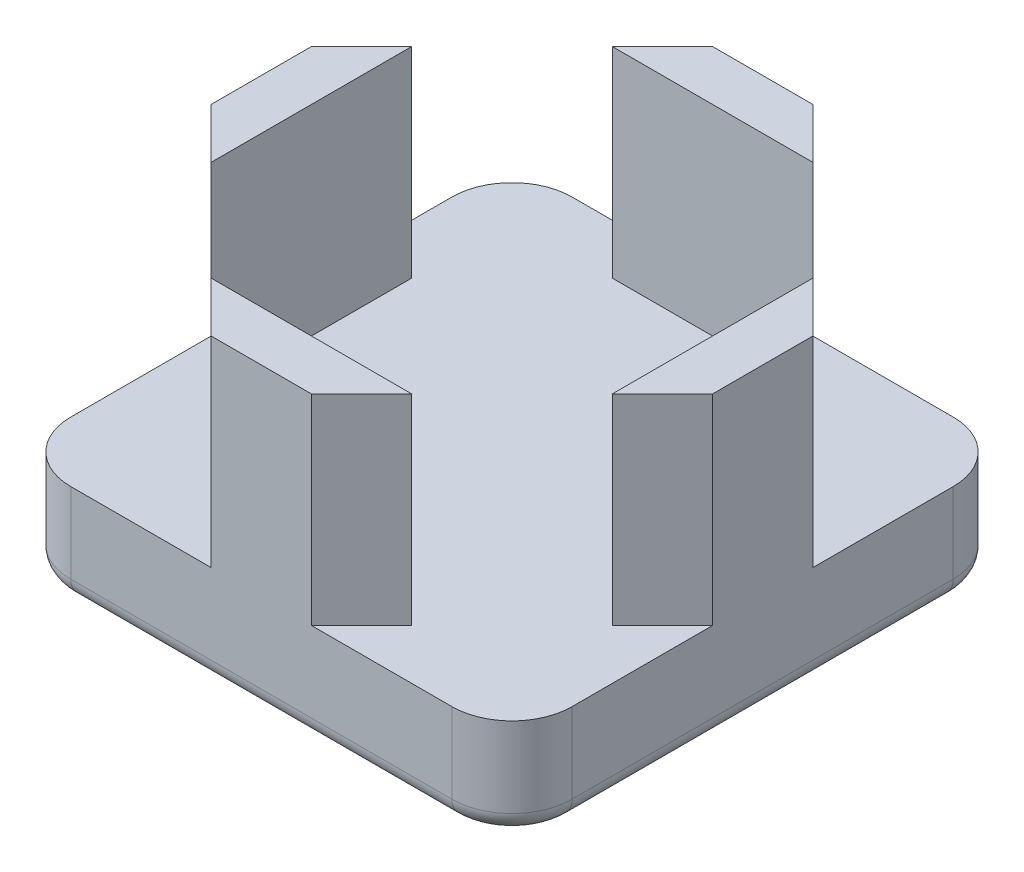
from build123d import *

# Parameters (mm, degrees)
BOSS_EXTRUDE1_DEPTH   = 10
BOSS_EXTRUDE1_2_DEPTH = 10
BOSS_EXTRUDE1_3_DEPTH = 10
BOSS_EXTRUDE1_4_DEPTH = 10
BOSS_EXTRUDE2_DEPTH   = 5
FILLET1_R             = 1


with BuildPart() as part:
    # Sketch3 → Boss-Extrude1 (new body)
    with BuildSketch(Plane(origin=(0, 0, 0), x_dir=(1, 0, 0), z_dir=(0, 1, 0))):
        Polygon((2.5, 12.5), (-2.5, 12.5), (-5, 10), (5, 10), align=None)
    extrude(amount=BOSS_EXTRUDE1_DEPTH)



with BuildPart() as body_2:
    # Sketch3 → Boss-Extrude1 2 (new body)
    with BuildSketch(Plane(origin=(0, 0, 0), x_dir=(1, 0, 0), z_dir=(0, 1, 0))):
        Polygon((-10, 5), (-12.5, 2.5), (-12.5, -2.5), (-10, -5), align=None)
    extrude(amount=BOSS_EXTRUDE1_2_DEPTH)


with BuildPart() as body_3:
    # Sketch3 → Boss-Extrude1 3 (new body)
    with BuildSketch(Plane(origin=(0, 0, 0), x_dir=(1, 0, 0), z_dir=(0, 1, 0))):
        Polygon((12.5, -2.5), (12.5, 2.5), (10, 5), (10, -5), align=None)
    extrude(amount=BOSS_EXTRUDE1_3_DEPTH)


with BuildPart() as body_4:
    # Sketch3 → Boss-Extrude1 4 (new body)
    with BuildSketch(Plane(origin=(0, 0, 0), x_dir=(1, 0, 0), z_dir=(0, 1, 0))):
        Polygon((-5, -10), (-2.5, -12.5), (2.5, -12.5), (5, -10), align=None)
    extrude(amount=BOSS_EXTRUDE1_4_DEPTH)


with BuildPart() as part_1:
    add(part.part)

    add(body_2.part)  # Boss-Extrude2 merges body 2

    add(body_3.part)  # Boss-Extrude2 merges body 3

    add(body_4.part)  # Boss-Extrude2 merges body 4
    # Sketch3<4> → Boss-Extrude2 (add)
    with BuildSketch(Plane(origin=(0, 0, 0), x_dir=(1, 0, 0), z_dir=(0, 1, 0))):
        with BuildLine():
            ThreePointArc((-9.5, 12.5), (-11.621320344, 11.621320344), (-12.5, 9.5))
            Line((-12.5, 9.5), (-12.5, -9.5))
            ThreePointArc((-12.5, -9.5), (-11.621320344, -11.621320344), (-9.5, -12.5))
            Line((-9.5, -12.5), (9.5, -12.5))
            ThreePointArc((9.5, -12.5), (11.621320344, -11.621320344), (12.5, -9.5))
            Line((12.5, -9.5), (12.5, 9.5))
            ThreePointArc((12.5, 9.5), (11.621320344, 11.621320344), (9.5, 12.5))
            Line((9.5, 12.5), (-9.5, 12.5))
        make_face()
    extrude(amount=-BOSS_EXTRUDE2_DEPTH)

    # Fillet1
    fillet1_edges = [part_1.edges().sort_by_distance(p)[0] for p in [
        (-11.621320344, -5, 11.621320344),
        (0, -5, 12.5),
        (11.621320344, -5, 11.621320344),
        (12.5, -5, 0),
        (11.621320344, -5, -11.621320344),
        (0, -5, -12.5),
        (-11.621320344, -5, -11.621320344),
        (-12.5, -5, 0),
    ]]
    fillet(fillet1_edges, radius=FILLET1_R)


solid = part_1.part
